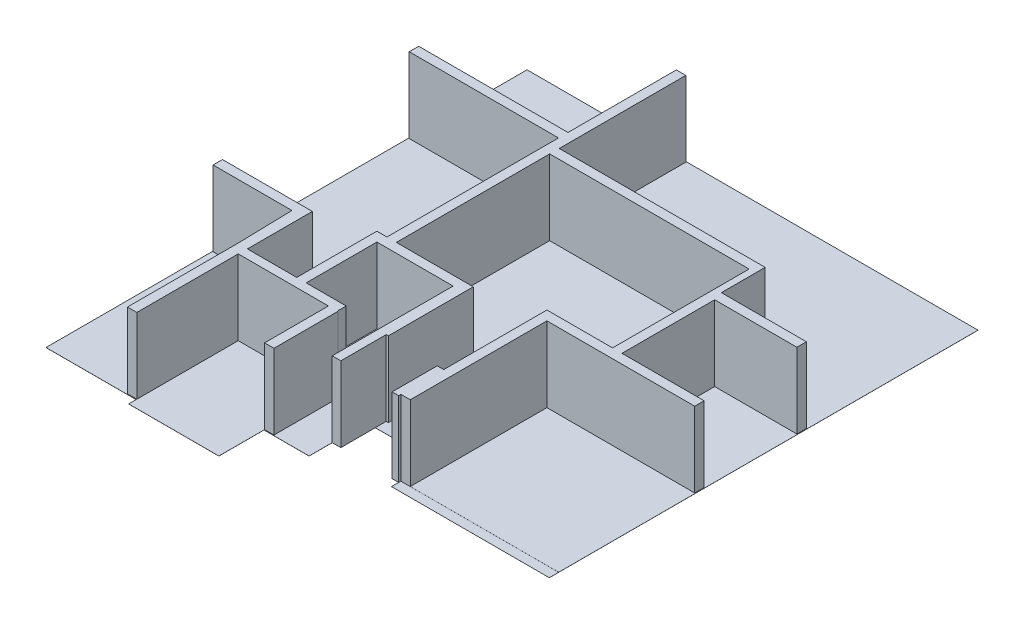
from build123d import *

# Parameters (mm, degrees)
BOSS_EXTRUDE1_DEPTH  = 2.54
BOSS_EXTRUDE2_DEPTH  = 3048
SKETCH3_W            = 6079.186928171
SKETCH3_H            = 384.95236651
BOSS_EXTRUDE3_DEPTH  = 3048
SKETCH4_W            = 6400.8
SKETCH4_H            = 381
BOSS_EXTRUDE4_DEPTH  = 3048
SKETCH5_W            = 435.20922465
SKETCH5_H            = 5334
BOSS_EXTRUDE5_DEPTH  = 3048
SKETCH6_W            = 381
SKETCH6_H            = 5922.610446976
BOSS_EXTRUDE7_DEPTH  = 3048
SKETCH7_W            = 6019.8
SKETCH7_H            = 381
BOSS_EXTRUDE8_DEPTH  = 3048
SKETCH8_W            = 381
SKETCH8_H            = 2613.731165123
BOSS_EXTRUDE9_DEPTH  = 3048
SKETCH9_W            = 381
SKETCH9_H            = 4182.504999838
BOSS_EXTRUDE10_DEPTH = 3048
SKETCH10_W           = 4005.822591779
SKETCH10_H           = 359.898893292
BOSS_EXTRUDE11_DEPTH = 3048
BOSS_EXTRUDE12_DEPTH = 3048
BOSS_EXTRUDE13_DEPTH = 3048
SKETCH14_W           = 381
SKETCH14_H           = 6217.587376367
BOSS_EXTRUDE15_DEPTH = 3048
SKETCH16_W           = 6400.8
SKETCH16_H           = 2122.559144169
CUT_EXTRUDE2_DEPTH   = 3048
SKETCH18_W           = 381
SKETCH18_H           = 3761.714555176
BOSS_EXTRUDE16_DEPTH = 3048
BOSS_EXTRUDE17_DEPTH = 3048
SKETCH20_W           = 381
SKETCH20_H           = 3048
CUT_EXTRUDE3_DEPTH   = 25.4
SKETCH21_W           = 381
SKETCH21_H           = 3048
CUT_EXTRUDE4_DEPTH   = 25.4
SKETCH22_W           = 2307.99077535
SKETCH22_H           = 3048
BOSS_EXTRUDE18_DEPTH = 1828.8
SKETCH23_W           = 2131.904617106
SKETCH23_H           = 3050.54
CUT_EXTRUDE5_DEPTH   = 1447.8
SKETCH24_W           = 348.138899176
SKETCH24_H           = 3050.54
CUT_EXTRUDE6_DEPTH   = 50.8
SKETCH26_W           = 2131.904617106
SKETCH26_H           = 3048
CUT_EXTRUDE7_DEPTH   = 441.706
SKETCH28_W           = 6400.8
SKETCH28_H           = 3050.286
CUT_EXTRUDE9_DEPTH   = 381
SKETCH29_W           = 384.95236651
SKETCH29_H           = 3050.286
CUT_EXTRUDE10_DEPTH  = 25.4
SKETCH30_W           = 381
SKETCH30_H           = 3050.286
CUT_EXTRUDE11_DEPTH  = 25.4
SKETCH31_W           = 381
SKETCH31_H           = 3050.286
CUT_EXTRUDE12_DEPTH  = 25.4
SKETCH32_W           = 384.95236651
SKETCH32_H           = 3050.286
CUT_EXTRUDE13_DEPTH  = 25.4
SKETCH33_W           = 384.95236651
SKETCH33_H           = 3050.286
CUT_EXTRUDE14_DEPTH  = 25.4


with BuildPart() as part:
    # Sketch1 → Boss-Extrude1 (new body)
    with BuildSketch(Plane(origin=(0, 0, 0), x_dir=(1, 0, 0), z_dir=(0, 1, 0))):
        Polygon((3657.6, 0), (3657.6, -304.8), (7315.2, -304.8), (7315.2, 0), (7315.2, 1524), (9144, 1524), (9144, 2413), (11887.2, 2413), (11887.2, 0), (18288, 0), (18288, 19507.2), (0, 19507.2), (0, 0), align=None)
    extrude(amount=BOSS_EXTRUDE1_DEPTH)

    # Sketch2 → Boss-Extrude2 (add)
    with BuildSketch(Plane(origin=(0, 2.54, 0), x_dir=(1, 0, 0), z_dir=(0, 1, 0))):
        Polygon((6079.186928171, 13964.587376367), (6079.186928171, 19507.2), (6464.139294681, 19507.2), (6464.139294681, 14349.539742877), (14814.644475897, 14349.539742877), (14814.644475897, 12572.836512831), (18288, 12572.836512831), (18288, 12187.884146321), (14548.13899139, 12187.884146321), (14548.13899139, 13964.587376367), align=None)
    extrude(amount=BOSS_EXTRUDE2_DEPTH)

    # Sketch3 → Boss-Extrude3 (add)
    with BuildSketch(Plane(origin=(0, 2.54, 0), x_dir=(1, 0, 0), z_dir=(0, 1, 0))):
        with Locations((3039.593464086, 14897.356572141)):
            Rectangle(SKETCH3_W, SKETCH3_H)
    extrude(amount=BOSS_EXTRUDE3_DEPTH)

    # Sketch4 → Boss-Extrude4 (add)
    with BuildSketch(Plane(origin=(0, 2.54, 0), x_dir=(1, 0, 0), z_dir=(0, 1, 0))):
        with Locations((15087.6, 2313.059144169)):
            Rectangle(SKETCH4_W, SKETCH4_H)
    extrude(amount=BOSS_EXTRUDE4_DEPTH)

    # Sketch5 → Boss-Extrude5 (add)
    with BuildSketch(Plane(origin=(0, 2.54, 0), x_dir=(1, 0, 0), z_dir=(0, 1, 0))):
        with Locations((9361.604612325, 5080)):
            Rectangle(SKETCH5_W, SKETCH5_H)
    extrude(amount=BOSS_EXTRUDE5_DEPTH)

    # Sketch6 → Boss-Extrude7 (add)
    with BuildSketch(Plane(origin=(0, 2.54, 0), x_dir=(1, 0, 0), z_dir=(0, 1, 0))):
        with Locations((12077.7, 5464.864367657)):
            Rectangle(SKETCH6_W, SKETCH6_H)
    extrude(amount=BOSS_EXTRUDE7_DEPTH)

    # Sketch7 → Boss-Extrude8 (add)
    with BuildSketch(Plane(origin=(0, 2.54, 0), x_dir=(1, 0, 0), z_dir=(0, 1, 0))):
        with Locations((15278.1, 8235.669591145)):
            Rectangle(SKETCH7_W, SKETCH7_H)
    extrude(amount=BOSS_EXTRUDE8_DEPTH)

    # Sketch8 → Boss-Extrude9 (add)
    with BuildSketch(Plane(origin=(0, 2.54, 0), x_dir=(1, 0, 0), z_dir=(0, 1, 0))):
        with Locations((7505.7, 2830.865582562)):
            Rectangle(SKETCH8_W, SKETCH8_H)
    extrude(amount=BOSS_EXTRUDE9_DEPTH)

    # Sketch9 → Boss-Extrude10 (add)
    with BuildSketch(Plane(origin=(0, 2.54, 0), x_dir=(1, 0, 0), z_dir=(0, 1, 0))):
        with Locations((3467.1, 2091.252499919)):
            Rectangle(SKETCH9_W, SKETCH9_H)
    extrude(amount=BOSS_EXTRUDE10_DEPTH)

    # Sketch10 → Boss-Extrude11 (add)
    with BuildSketch(Plane(origin=(0, 2.54, 0), x_dir=(1, 0, 0), z_dir=(0, 1, 0))):
        with Locations((5671.281263235, 4317.680611769)):
            Rectangle(SKETCH10_W, SKETCH10_H)
    extrude(amount=BOSS_EXTRUDE11_DEPTH)

    # Sketch11 → Boss-Extrude12 (add)
    with BuildSketch(Plane(origin=(0, 2.54, 0), x_dir=(1, 0, 0), z_dir=(0, 1, 0))):
        Polygon((3276.6, 4182.504999838), (3276.6, 4499.719299199), (3668.369967345, 4497.630058415), (3668.369967345, 4137.731165123), (3657.6, 4137.731165123), (3657.6, 4182.504999838), align=None)
    extrude(amount=BOSS_EXTRUDE12_DEPTH)

    # Sketch13 → Boss-Extrude13 (add)
    with BuildSketch(Plane(origin=(0, 2.54, 0), x_dir=(1, 0, 0), z_dir=(0, 1, 0))):
        Polygon((9144, 7747), (5671.281263235, 7747), (5671.281263235, 4497.630058415), (6052.281263235, 4497.630058415), (6052.281263235, 7366), (9144, 7366), align=None)
    extrude(amount=BOSS_EXTRUDE13_DEPTH)

    # Sketch14 → Boss-Extrude15 (add)
    with BuildSketch(Plane(origin=(0, 2.54, 0), x_dir=(1, 0, 0), z_dir=(0, 1, 0))):
        with Locations((6269.686928171, 10855.793688184)):
            Rectangle(SKETCH14_W, SKETCH14_H)
    extrude(amount=BOSS_EXTRUDE15_DEPTH)

    # Sketch16 → Cut-Extrude2 (cut)
    with BuildSketch(Plane(origin=(0, 2.54, 0), x_dir=(1, 0, 0), z_dir=(0, 1, 0))):
        with Locations((15087.6, 1061.279572085)):
            Rectangle(SKETCH16_W, SKETCH16_H)
    extrude(amount=-CUT_EXTRUDE2_DEPTH, mode=Mode.SUBTRACT)

    # Sketch18 → Boss-Extrude16 (add)
    with BuildSketch(Plane(origin=(0, 2.54, 0), x_dir=(1, 0, 0), z_dir=(0, 1, 0))):
        with Locations((14738.63899139, 10307.026868733)):
            Rectangle(SKETCH18_W, SKETCH18_H)
    extrude(amount=BOSS_EXTRUDE16_DEPTH)

    # Sketch19 → Boss-Extrude17 (add)
    with BuildSketch(Plane(origin=(0, 2.54, 0), x_dir=(1, 0, 0), z_dir=(0, 1, 0))):
        Polygon((3276.6, 4499.719299199), (3668.369967345, 4497.630058415), (3668.369967345, 7132.849148223), (0, 7132.849148223), (0, 6751.849148223), (3221.67385658, 6751.849148223), align=None)
    extrude(amount=BOSS_EXTRUDE17_DEPTH)

    # Sketch20 → Cut-Extrude3 (cut)
    with BuildSketch(Plane.XY):
        with Locations((3467.1, 1526.54)):
            Rectangle(SKETCH20_W, SKETCH20_H)
    extrude(amount=-CUT_EXTRUDE3_DEPTH, mode=Mode.SUBTRACT)

    # Sketch21 → Cut-Extrude4 (cut)
    with BuildSketch(Plane.XY.offset(-1524)):
        with Locations((7505.7, 1526.54)):
            Rectangle(SKETCH21_W, SKETCH21_H)
    extrude(amount=-CUT_EXTRUDE4_DEPTH, mode=Mode.SUBTRACT)

    # Sketch22 → Boss-Extrude18 (add)
    with BuildSketch(Plane.XY.offset(-2413)):
        with Locations((10733.204612325, 1526.54)):
            Rectangle(SKETCH22_W, SKETCH22_H)
    extrude(amount=-BOSS_EXTRUDE18_DEPTH)

    # Sketch23 → Cut-Extrude5 (cut)
    with BuildSketch(Plane.XY.offset(-2413)):
        with Locations((10558.091207729, 1525.27)):
            Rectangle(SKETCH23_W, SKETCH23_H)
    extrude(amount=-CUT_EXTRUDE5_DEPTH, mode=Mode.SUBTRACT)

    # Sketch24 → Cut-Extrude6 (cut)
    with BuildSketch(Plane.XY.offset(-2413)):
        with Locations((9318.069449588, 1525.27)):
            Rectangle(SKETCH24_W, SKETCH24_H)
    extrude(amount=-CUT_EXTRUDE6_DEPTH, mode=Mode.SUBTRACT)

    # Sketch26 → Cut-Extrude7 (cut)
    with BuildSketch(Plane.XY.offset(-3860.8)):
        with Locations((10558.091207729, 1526.54)):
            Rectangle(SKETCH26_W, SKETCH26_H)
    extrude(amount=-CUT_EXTRUDE7_DEPTH, mode=Mode.SUBTRACT)

    # Sketch28 → Cut-Extrude9 (cut)
    with BuildSketch(Plane.XY.offset(-2122.559144169)):
        with Locations((15087.6, 1525.397)):
            Rectangle(SKETCH28_W, SKETCH28_H)
    extrude(amount=-CUT_EXTRUDE9_DEPTH, mode=Mode.SUBTRACT)

    # Sketch29 → Cut-Extrude10 (cut)
    with BuildSketch(Plane.ZY):
        with Locations((-14897.356572141, 1525.397)):
            Rectangle(SKETCH29_W, SKETCH29_H)
    extrude(amount=-CUT_EXTRUDE10_DEPTH, mode=Mode.SUBTRACT)

    # Sketch30 → Cut-Extrude11 (cut)
    with BuildSketch(Plane.ZY):
        with Locations((-6942.349148223, 1525.397)):
            Rectangle(SKETCH30_W, SKETCH30_H)
    extrude(amount=-CUT_EXTRUDE11_DEPTH, mode=Mode.SUBTRACT)

    # Sketch31 → Cut-Extrude12 (cut)
    with BuildSketch(Plane(origin=(18288, 0, 0), x_dir=(0, 0, -1), z_dir=(1, 0, 0))):
        with Locations((8235.669591145, 1525.397)):
            Rectangle(SKETCH31_W, SKETCH31_H)
    extrude(amount=-CUT_EXTRUDE12_DEPTH, mode=Mode.SUBTRACT)

    # Sketch32 → Cut-Extrude13 (cut)
    with BuildSketch(Plane(origin=(18288, 0, 0), x_dir=(0, 0, -1), z_dir=(1, 0, 0))):
        with Locations((12380.360329576, 1525.397)):
            Rectangle(SKETCH32_W, SKETCH32_H)
    extrude(amount=-CUT_EXTRUDE13_DEPTH, mode=Mode.SUBTRACT)

    # Sketch33 → Cut-Extrude14 (cut)
    with BuildSketch(Plane(origin=(0, 0, -19507.2), x_dir=(-1, 0, 0), z_dir=(0, 0, -1))):
        with Locations((-6271.663111426, 1525.397)):
            Rectangle(SKETCH33_W, SKETCH33_H)
    extrude(amount=-CUT_EXTRUDE14_DEPTH, mode=Mode.SUBTRACT)


solid = part.part
